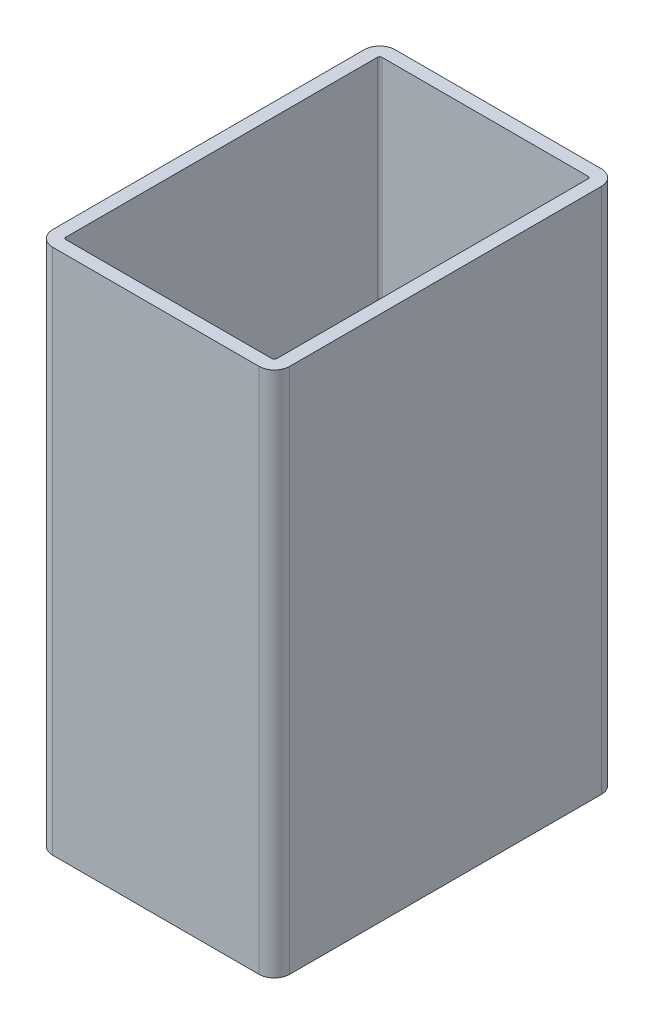
from build123d import *

# Parameters (mm, degrees)
RHS_RHS90X50X5_1_DEPTH = 400


with BuildPart() as part:
    # Sketch115 → Rhs RHS90X50X5(1) (new body)
    with BuildSketch(Plane(origin=(0, 0, 0), x_dir=(-1, 0, 0), z_dir=(0, 1, 0))):
        with BuildLine():
            Line((-78.333333333, -130), (78.333333333, -130))
            ThreePointArc((78.333333333, -130), (86.582912447, -126.582912447), (90, -118.333333333))
            Line((90, -118.333333333), (90, 118.333333333))
            ThreePointArc((90, 118.333333333), (86.582912447, 126.582912447), (78.333333333, 130))
            Line((78.333333333, 130), (-78.333333333, 130))
            ThreePointArc((-78.333333333, 130), (-86.582912447, 126.582912447), (-90, 118.333333333))
            Line((-90, 118.333333333), (-90, -118.333333333))
            ThreePointArc((-90, -118.333333333), (-86.582912447, -126.582912447), (-78.333333333, -130))
        make_face()
        with BuildLine():
            Line((-78.333333333, -120), (78.333333333, -120))
            ThreePointArc((78.333333333, -120), (79.511844635, -119.511844635), (80, -118.333333333))
            Line((80, -118.333333333), (80, 118.333333333))
            ThreePointArc((80, 118.333333333), (79.511844635, 119.511844635), (78.333333333, 120))
            Line((78.333333333, 120), (-78.333333333, 120))
            ThreePointArc((-78.333333333, 120), (-79.511844635, 119.511844635), (-80, 118.333333333))
            Line((-80, 118.333333333), (-80, -118.333333333))
            ThreePointArc((-80, -118.333333333), (-79.511844635, -119.511844635), (-78.333333333, -120))
        make_face(mode=Mode.SUBTRACT)
    extrude(amount=RHS_RHS90X50X5_1_DEPTH)


solid = part.part
